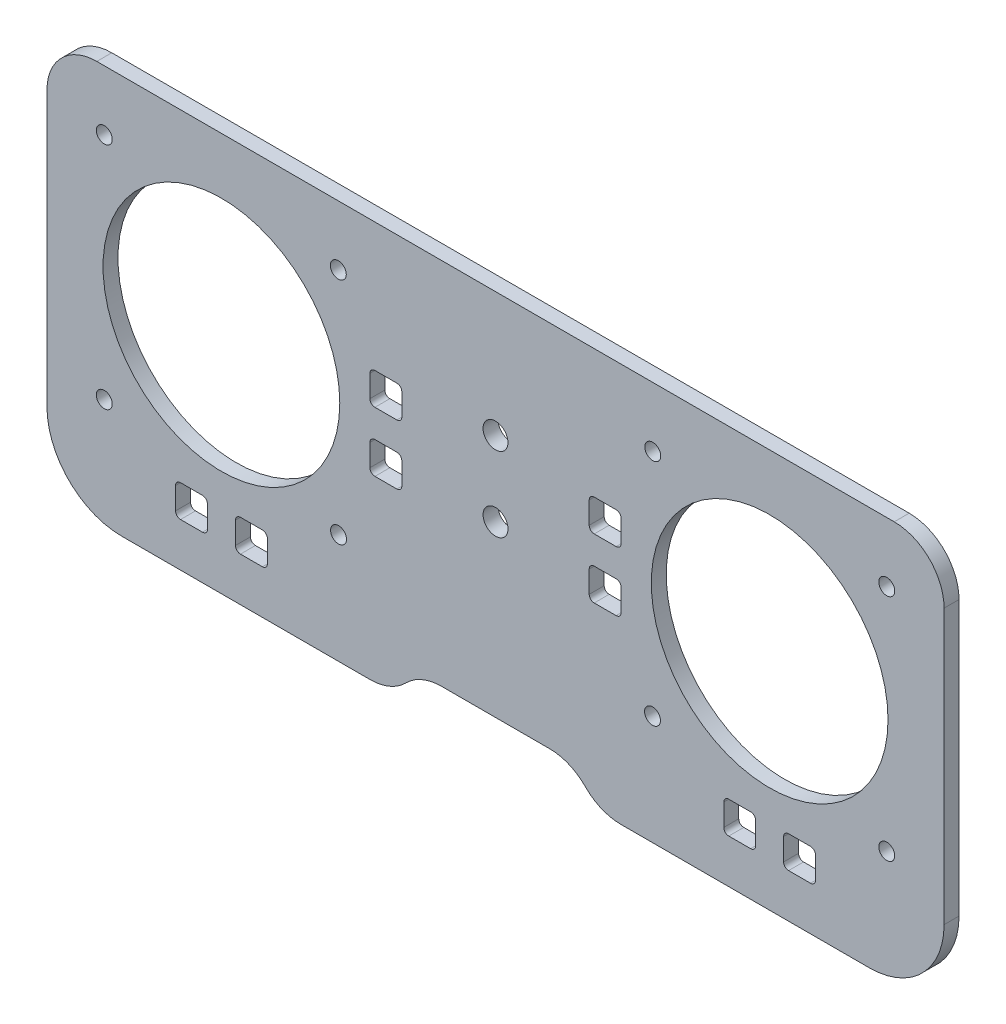
from build123d import *

# Parameters (mm, degrees)
SKETCH1_W           = 180
SKETCH1_H           = 80
SKETCH1_R           = 23.75
BOSS_EXTRUDE1_DEPTH = 3
SKETCH2_W           = 6.4
SKETCH2_H           = 6.4
SKETCH2_W_2         = 6.402436435
CUT_EXTRUDE1_DEPTH  = 99.534258002
CUT_EXTRUDE2_DEPTH  = 3
SKETCH4_R           = 1.6
CUT_EXTRUDE3_DEPTH  = 3
SKETCH7_R           = 2.5
CUT_EXTRUDE4_DEPTH  = 3
FILLET1_R           = 10
FILLET2_R           = 15
FILLET3_R           = 10
FILLET4_R           = 1


with BuildPart() as part:
    # Sketch1 → Boss-Extrude1 (new body)
    with BuildSketch(Plane.XY):
        Rectangle(SKETCH1_W, SKETCH1_H)
        with Locations((55, 5)):
            Circle(SKETCH1_R, mode=Mode.SUBTRACT)
        with Locations((-55, 5)):
            Circle(SKETCH1_R, mode=Mode.SUBTRACT)
    extrude(amount=BOSS_EXTRUDE1_DEPTH)

    # Sketch2 → Cut-Extrude1 (cut, through all)
    with BuildSketch(Plane.XY.offset(3)):
        with Locations((-61, -28)):
            Rectangle(SKETCH2_W, SKETCH2_H)
        with Locations((-48.976364432, -28)):
            Rectangle(SKETCH2_W_2, SKETCH2_H)
        with Locations((-22, -1)):
            Rectangle(SKETCH2_W, SKETCH2_H)
        with Locations((-22, 11)):
            Rectangle(SKETCH2_W, SKETCH2_H)
        with Locations((22, -1)):
            Rectangle(SKETCH2_W, SKETCH2_H)
        with Locations((22, 11)):
            Rectangle(SKETCH2_W, SKETCH2_H)
        with Locations((49, -28)):
            Rectangle(SKETCH2_W, SKETCH2_H)
        with Locations((61, -28)):
            Rectangle(SKETCH2_W, SKETCH2_H)
    extrude(amount=-CUT_EXTRUDE1_DEPTH, mode=Mode.SUBTRACT)

    # Sketch3 → Cut-Extrude2 (cut)
    with BuildSketch(Plane.XY.offset(3)):
        Polygon((-21, -40), (-15, -34), (15, -34), (21, -40), align=None)
    extrude(amount=-CUT_EXTRUDE2_DEPTH, mode=Mode.SUBTRACT)

    # Sketch4 → Cut-Extrude3 (cut)
    with BuildSketch(Plane.XY.offset(3)):
        with Locations((-78.5, 28)):
            Circle(SKETCH4_R)
        with Locations((-31.545874822, 28)):
            Circle(SKETCH4_R)
        with Locations((-31.5, -18)):
            Circle(SKETCH4_R)
        with Locations((-78.5, -18)):
            Circle(SKETCH4_R)
        with Locations(Location((31.5, -18, 0), (0, 0, 180))):
            Circle(SKETCH4_R)
        with Locations(Location((31.545874822, 28, 0), (0, 0, 180))):
            Circle(SKETCH4_R)
        with Locations(Location((78.5, 28, 0), (0, 0, 180))):
            Circle(SKETCH4_R)
        with Locations(Location((78.5, -18, 0), (0, 0, 180))):
            Circle(SKETCH4_R)
    extrude(amount=-CUT_EXTRUDE3_DEPTH, mode=Mode.SUBTRACT)

    # Sketch7 → Cut-Extrude4 (cut)
    with BuildSketch(Plane.XY.offset(3)):
        Circle(SKETCH7_R)
        with Locations((0, 15)):
            Circle(SKETCH7_R)
    extrude(amount=-CUT_EXTRUDE4_DEPTH, mode=Mode.SUBTRACT)

    # Fillet1
    fillet1_edges = [part.edges().sort_by_distance(p)[0] for p in [
        (-90, 40, 1.5),
        (90, 40, 1.5),
    ]]
    fillet(fillet1_edges, radius=FILLET1_R)

    # Fillet2
    fillet2_edges = [part.edges().sort_by_distance(p)[0] for p in [
        (90, -40, 1.5),
        (-90, -40, 1.5),
    ]]
    fillet(fillet2_edges, radius=FILLET2_R)

    # Fillet3
    fillet3_edges = [part.edges().sort_by_distance(p)[0] for p in [
        (-15, -34, 1.5),
        (15, -34, 1.5),
        (21, -40, 1.5),
        (-21, -40, 1.5),
    ]]
    fillet(fillet3_edges, radius=FILLET3_R)

    # Fillet4
    fillet4_edges = [part.edges().sort_by_distance(p)[0] for p in [
        (45.8, -31.2, 1.5),
        (45.8, -24.8, 1.5),
        (52.2, -24.8, 1.5),
        (52.2, -31.2, 1.5),
        (57.8, -31.2, 1.5),
        (57.8, -24.8, 1.5),
        (64.2, -24.8, 1.5),
        (64.2, -31.2, 1.5),
        (-64.2, -24.8, 1.5),
        (-57.8, -24.8, 1.5),
        (-57.8, -31.2, 1.5),
        (-64.2, -31.2, 1.5),
        (-52.177582649, -31.2, 1.5),
        (-52.177582649, -24.8, 1.5),
        (-45.775146214, -24.8, 1.5),
        (-45.775146214, -31.2, 1.5),
        (-25.2, -4.2, 1.5),
        (-25.2, 2.2, 1.5),
        (-18.8, 2.2, 1.5),
        (-18.8, -4.2, 1.5),
        (-25.2, 7.8, 1.5),
        (-25.2, 14.2, 1.5),
        (-18.8, 14.2, 1.5),
        (-18.8, 7.8, 1.5),
        (18.8, -4.2, 1.5),
        (18.8, 2.2, 1.5),
        (25.2, 2.2, 1.5),
        (25.2, -4.2, 1.5),
        (18.8, 7.8, 1.5),
        (18.8, 14.2, 1.5),
        (25.2, 14.2, 1.5),
        (25.2, 7.8, 1.5),
    ]]
    fillet(fillet4_edges, radius=FILLET4_R)


solid = part.part
